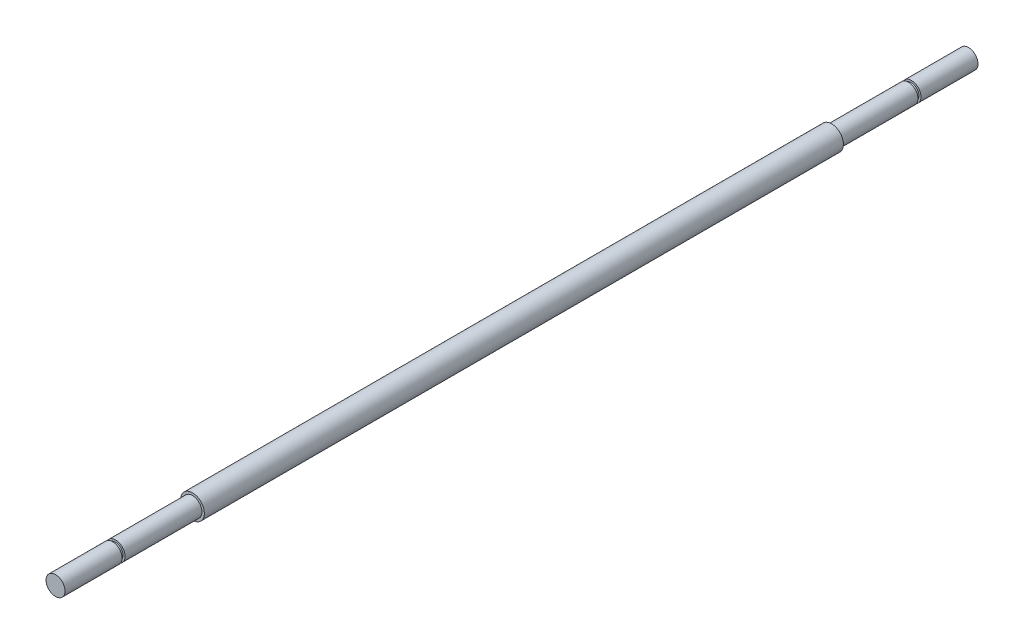
from build123d import *

# Parameters (mm, degrees)
SKETCH1_R           = 7.9375
BOSS_EXTRUDE1_DEPTH = 609.6
FILLET1_R           = 0.25
SKETCH2_W           = 1.5875
SKETCH2_H           = 91.44
SKETCH4_W           = 2.6416
SKETCH4_H           = 2


with BuildPart() as part:
    # Sketch1 → Boss-Extrude1 (new body)
    with BuildSketch(Plane.XY):
        with Locations(Location((0, 0, 0), (0, 0, 180))):
            Circle(SKETCH1_R)
    extrude(amount=BOSS_EXTRUDE1_DEPTH)

    # Fillet1
    fillet1_edges = [part.edges().sort_by_distance(p)[0] for p in [
        (7.9375, 0, 0),
        (7.9375, 0, 609.6),
    ]]
    fillet(fillet1_edges, radius=FILLET1_R)

    # Sketch2 → Cut-Revolve2 (revolve, cut)
    with BuildSketch(Plane(origin=(0, 0, 0), x_dir=(1, 0, 0), z_dir=(0, 1, 0)), mode=Mode.PRIVATE) as cut_revolve2_sk:
        with Locations((7.14375, -45.72)):
            Rectangle(SKETCH2_W, SKETCH2_H)
    cut_revolve2 = revolve(cut_revolve2_sk.sketch.rotate(Axis((0, 0, 0.780201326), (0, 0, 1)), 180), axis=Axis((0, 0, 0.780201326), (0, 0, 1)), mode=Mode.SUBTRACT)

    # Sketch4 → Cut-Revolve3 (revolve, cut)
    with BuildSketch(Plane(origin=(0, 0, 0), x_dir=(1, 0, 0), z_dir=(0, 1, 0)), mode=Mode.PRIVATE) as cut_revolve3_sk:
        with Locations((6.35, -39.1)):
            Rectangle(SKETCH4_W, SKETCH4_H)
    cut_revolve3 = revolve(cut_revolve3_sk.sketch.rotate(Axis((0, 0, 0), (0, 0, 1)), 180), axis=Axis((0, 0, 0), (0, 0, 1)), mode=Mode.SUBTRACT)

    # Mirror1: Cut-Revolve2, Cut-Revolve3 across plane
    add(cut_revolve2.mirror(Plane.XY.offset(304.8)), mode=Mode.SUBTRACT)
    add(cut_revolve3.mirror(Plane.XY.offset(304.8)), mode=Mode.SUBTRACT)


solid = part.part
